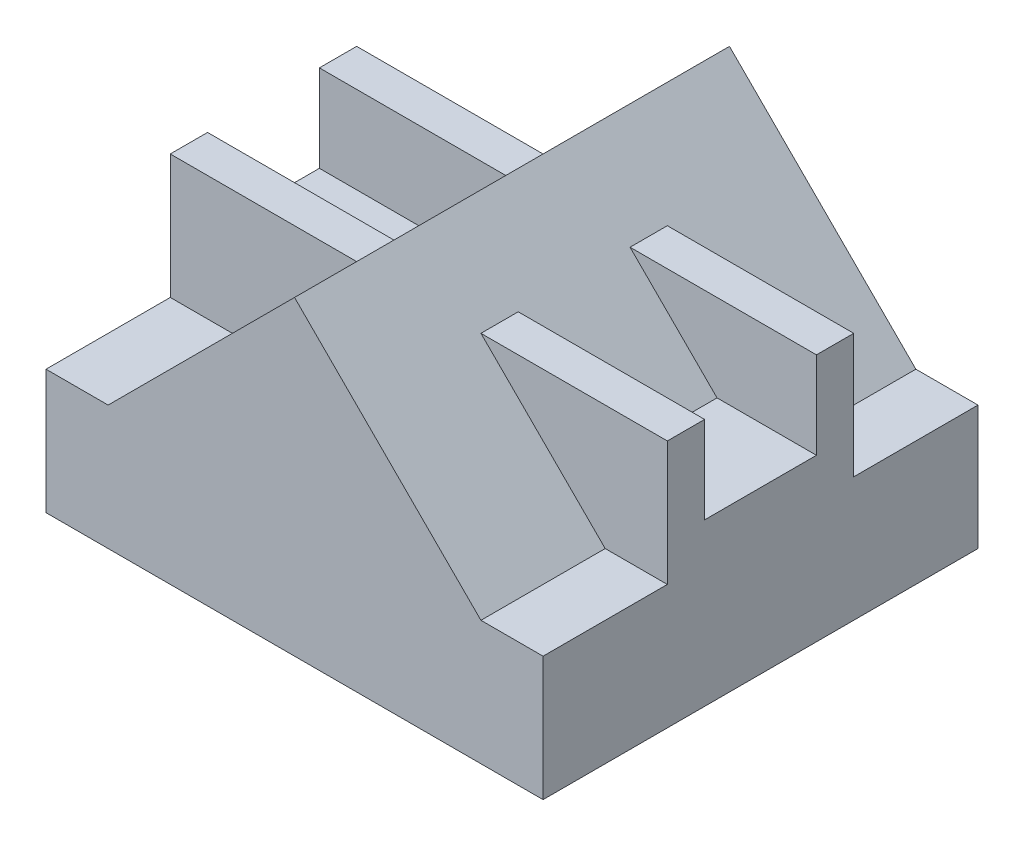
from build123d import *

# Parameters (mm, degrees)
SKETCH1_W           = 100
SKETCH1_H           = 50
SKETCH1_H_2         = 15
SKETCH1_H_3         = 22.5
BOSS_EXTRUDE1_DEPTH = 50
SKETCH1_3_W         = 100
SKETCH1_3_H         = 15
BOSS_EXTRUDE2_DEPTH = 100
BOSS_EXTRUDE3_START = 50
SKETCH1_4_W         = 100
SKETCH1_4_H         = 22.5
BOSS_EXTRUDE3_DEPTH = 15
BOSS_EXTRUDE4_DEPTH = 87.5


with BuildPart() as part:
    # Sketch1 → Boss-Extrude1 (new body)
    with BuildSketch(Plane(origin=(0, 0, 0), x_dir=(1, 0, 0), z_dir=(0, 1, 0))):
        with Locations((50, 25)):
            Rectangle(SKETCH1_W, SKETCH1_H)
        with Locations((50, 57.5)):
            Rectangle(SKETCH1_W, SKETCH1_H_2)
        with Locations((50, 76.25)):
            Rectangle(SKETCH1_W, SKETCH1_H_3)
    boss_extrude1 = extrude(amount=BOSS_EXTRUDE1_DEPTH)

    # Sketch1<3> → Boss-Extrude2 (add)
    with BuildSketch(Plane(origin=(0, 0, 0), x_dir=(1, 0, 0), z_dir=(0, 1, 0))):
        with Locations((50, 57.5)):
            Rectangle(SKETCH1_3_W, SKETCH1_3_H)
    boss_extrude2 = extrude(amount=BOSS_EXTRUDE2_DEPTH)

    # Sketch1<4> → Boss-Extrude3 (add)
    with BuildSketch(Plane(origin=(0, 0, 0), x_dir=(1, 0, 0), z_dir=(0, 1, 0)).offset(BOSS_EXTRUDE3_START)):
        with Locations((50, 76.25)):
            Rectangle(SKETCH1_4_W, SKETCH1_4_H)
    boss_extrude3 = extrude(amount=BOSS_EXTRUDE3_DEPTH)

    # Sketch2 → Boss-Extrude4 (add)
    with BuildSketch(Plane.XY):
        Polygon((0, 125), (75, 50), (0, 50), align=None)
    boss_extrude4 = extrude(amount=-BOSS_EXTRUDE4_DEPTH)

    # Mirror1: Boss-Extrude1, Boss-Extrude2, Boss-Extrude3, Boss-Extrude4 across plane
    add(boss_extrude1.mirror(Plane(origin=(0, 50, -87.5), x_dir=(1, 0, 0), z_dir=(0, 0, -1))))
    add(boss_extrude2.mirror(Plane(origin=(0, 50, -87.5), x_dir=(1, 0, 0), z_dir=(0, 0, -1))))
    add(boss_extrude3.mirror(Plane(origin=(0, 50, -87.5), x_dir=(1, 0, 0), z_dir=(0, 0, -1))))
    add(boss_extrude4.mirror(Plane(origin=(0, 50, -87.5), x_dir=(1, 0, 0), z_dir=(0, 0, -1))))

    # Mirror10: part across plane


with BuildPart() as part_1:
    add(part.part)
    add(part.part.mirror(Plane(origin=(0, 50, 0), x_dir=(0, 0, 1), z_dir=(-1, 0, 0))))


solid = part_1.part
